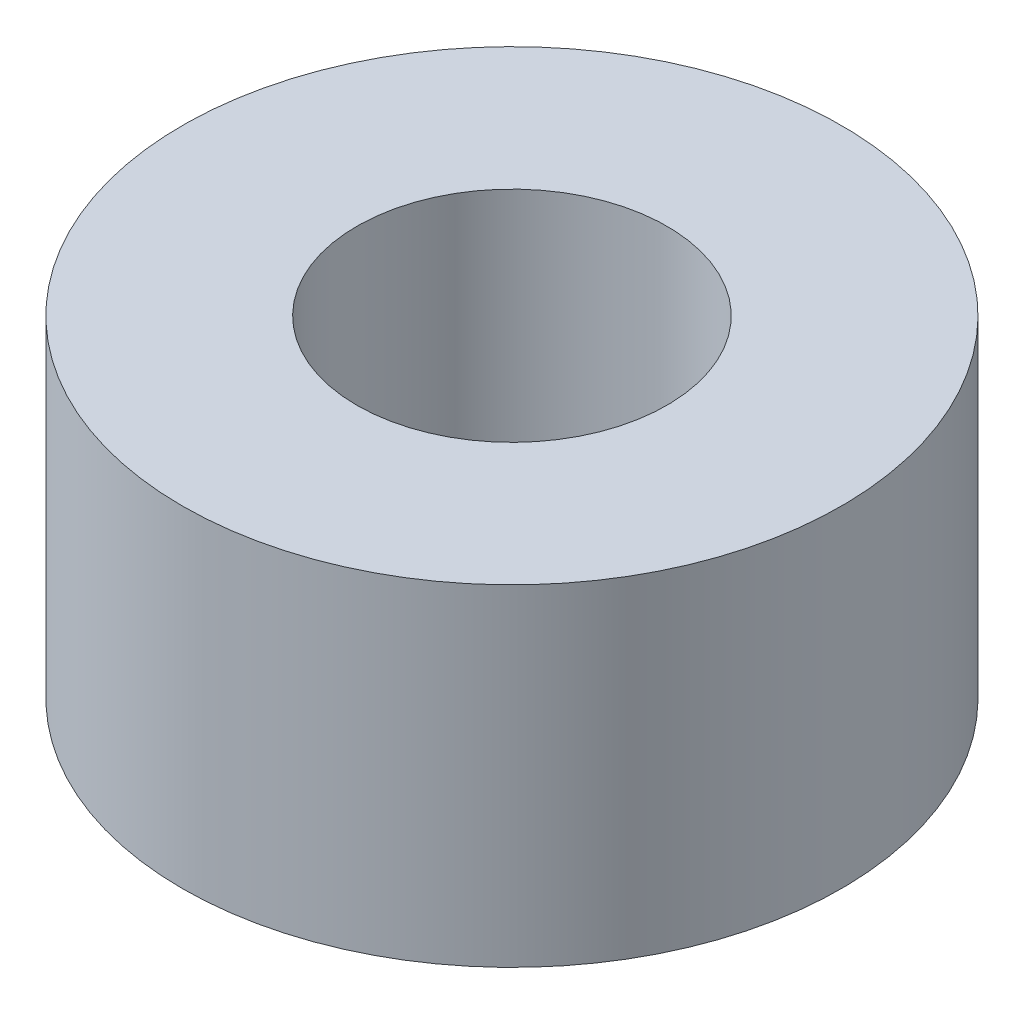
from build123d import *

# Parameters (mm, degrees)
SKETCH1_R           = 4.675
SKETCH1_R_2         = 2.2
BOSS_EXTRUDE1_DEPTH = 4.7


with BuildPart() as part:
    # Sketch1 → Boss-Extrude1 (new body)
    with BuildSketch(Plane(origin=(0, 0, 0), x_dir=(1, 0, 0), z_dir=(0, 1, 0))):
        with Locations(Location((0, 0, 0), (0, 0, 270))):
            Circle(SKETCH1_R)
        with Locations(Location((0, 0, 0), (0, 0, 270))):
            Circle(SKETCH1_R_2, mode=Mode.SUBTRACT)
    extrude(amount=BOSS_EXTRUDE1_DEPTH)


solid = part.part
